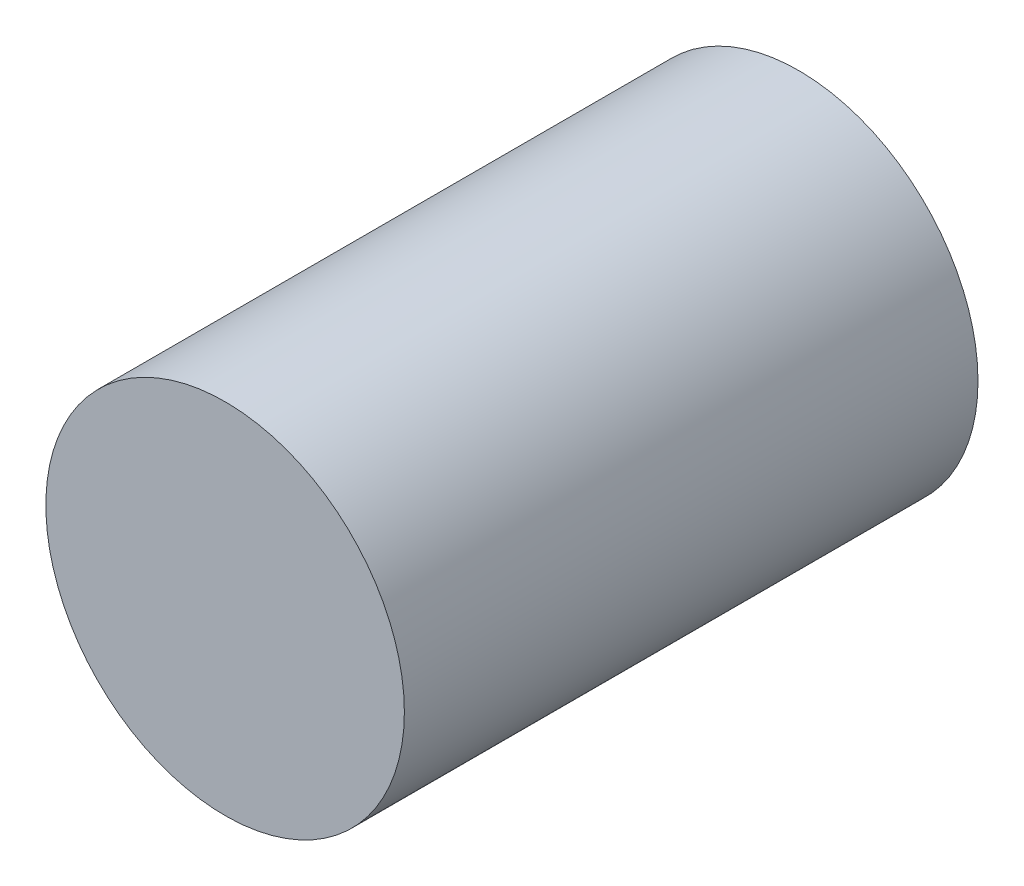
from build123d import *

# Parameters (mm, degrees)
SKETCH_1_R      = 5
EXTRUDE_1_DEPTH = 16


with BuildPart() as part:
    # 스케치1 → 보스-돌출1 (new body)
    with BuildSketch(Plane.XY):
        Circle(SKETCH_1_R)
    extrude(amount=EXTRUDE_1_DEPTH)


solid = part.part
